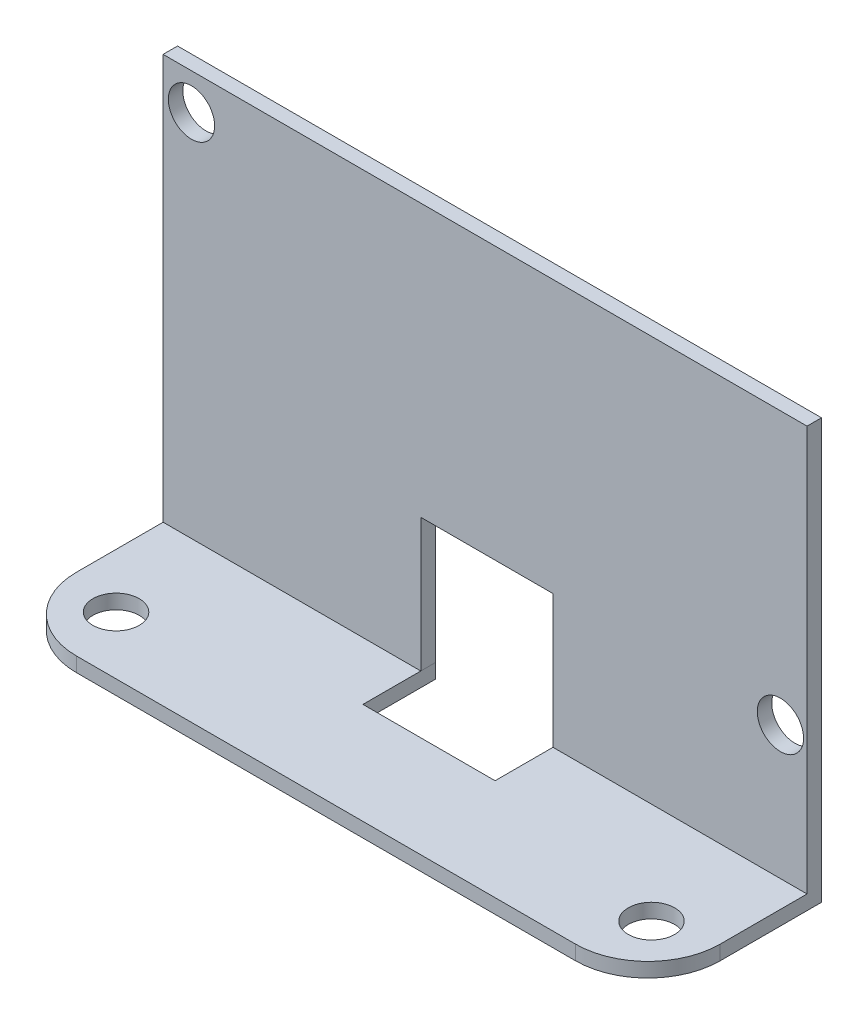
from build123d import *

# Parameters (mm, degrees)
SKETCH1_W           = 44.5
SKETCH1_H           = 29
BOSS_EXTRUDE1_DEPTH = 12
SKETCH2_W           = 11
SKETCH2_H           = 28
CUT_EXTRUDE1_DEPTH  = 52.240207176
SKETCH3_R           = 1.6
SKETCH3_W           = 9.133902139
SKETCH3_H           = 9.2
CUT_EXTRUDE2_DEPTH  = 16.77
SKETCH4_R           = 1.6
CUT_EXTRUDE4_DEPTH  = 16.77
FILLET1_R           = 5
FILLET2_R           = 5
SKETCH11_W          = 9.133756838
SKETCH11_H          = 2
CUT_EXTRUDE7_DEPTH  = 5


with BuildPart() as part:
    # Sketch1 → Boss-Extrude1 (new body)
    with BuildSketch(Plane.XY):
        with Locations((4.092804291, -7.889927007)):
            Rectangle(SKETCH1_W, SKETCH1_H)
    extrude(amount=BOSS_EXTRUDE1_DEPTH)

    # Sketch2 → Cut-Extrude1 (cut, through all)
    with BuildSketch(Plane.ZY.offset(18.157195709)):
        with Locations((6.5, -7.389927007)):
            Rectangle(SKETCH2_W, SKETCH2_H)
    extrude(amount=-CUT_EXTRUDE1_DEPTH, mode=Mode.SUBTRACT)

    # Sketch3 → Cut-Extrude2 (cut)
    with BuildSketch(Plane.XY.offset(1)):
        with Locations((-16.195951252, 4.110072993)):
            Circle(SKETCH3_R)
        with Locations((24.504048748, -12.189927007)):
            Circle(SKETCH3_R)
        with Locations((4.21890888, -16.789927007)):
            Rectangle(SKETCH3_W, SKETCH3_H)
    extrude(amount=-CUT_EXTRUDE2_DEPTH, mode=Mode.SUBTRACT)

    # Sketch4 → Cut-Extrude4 (cut)
    with BuildSketch(Plane(origin=(0, -21.389927007, 0), x_dir=(1, 0, 0), z_dir=(0, 1, 0))):
        with Locations(Location((-14.407195709, -8, 0), (0, 0, 270))):
            Circle(SKETCH4_R)
        with Locations(Location((22.592804291, -8, 0), (0, 0, 270))):
            Circle(SKETCH4_R)
    extrude(amount=-CUT_EXTRUDE4_DEPTH, mode=Mode.SUBTRACT)

    # Fillet1
    fillet1_edges = [part.edges().sort_by_distance(p)[0] for p in [
        (-18.157195709, -21.889927007, 12),
    ]]
    fillet(fillet1_edges, radius=FILLET1_R)

    # Fillet2
    fillet2_edges = [part.edges().sort_by_distance(p)[0] for p in [
        (26.342804291, -21.889927007, 12),
    ]]
    fillet(fillet2_edges, radius=FILLET2_R)

    # Sketch11 → Cut-Extrude7 (cut)
    with BuildSketch(Plane(origin=(0, 0, 0), x_dir=(-1, 0, 0), z_dir=(0, 0, -1))):
        with Locations((-4.21898153, -22.389927007)):
            Rectangle(SKETCH11_W, SKETCH11_H)
    extrude(amount=-CUT_EXTRUDE7_DEPTH, mode=Mode.SUBTRACT)


solid = part.part
